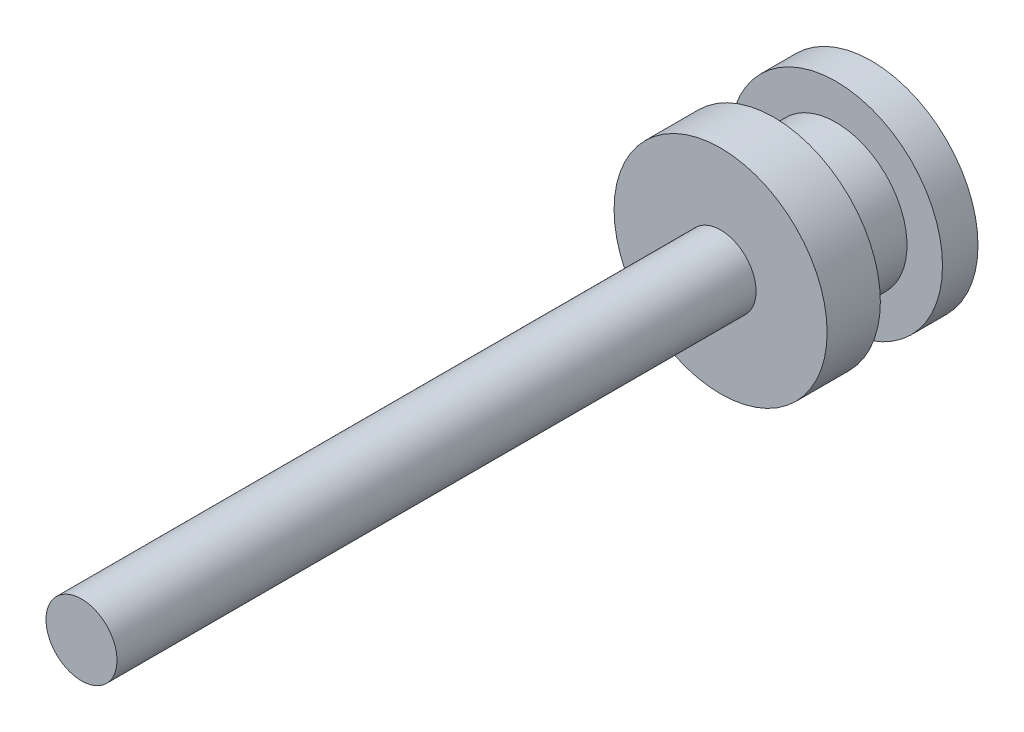
from build123d import *

# Parameters (mm, degrees)
SKIZZE1_R                       = 60
AUFSATZ_LINEAR_AUSTRAGEN1_DEPTH = 30
SKIZZE2_R                       = 20
AUFSATZ_LINEAR_AUSTRAGEN2_DEPTH = 360
SKIZZE3_R                       = 40
AUFSATZ_LINEAR_AUSTRAGEN3_DEPTH = 35
AUFSATZ_LINEAR_START            = 20
SKIZZE4_R                       = 60
AUFSATZ_LINEAR_AUSTRAGEN4_DEPTH = 20


with BuildPart() as part:
    # Skizze1 → Aufsatz-Linear austragen1 (new body)
    with BuildSketch(Plane.XY):
        Circle(SKIZZE1_R)
    extrude(amount=AUFSATZ_LINEAR_AUSTRAGEN1_DEPTH)

    # Skizze2 → Aufsatz-Linear austragen2 (add)
    with BuildSketch(Plane.XY.offset(30)):
        with Locations(Location((0, 0, 0), (0, 0, 180))):
            Circle(SKIZZE2_R)
    extrude(amount=AUFSATZ_LINEAR_AUSTRAGEN2_DEPTH)

    # Skizze3 → Aufsatz-Linear austragen3 (add)
    with BuildSketch(Plane(origin=(0, 0, 0), x_dir=(-1, 0, 0), z_dir=(0, 0, -1))):
        Circle(SKIZZE3_R)
    extrude(amount=AUFSATZ_LINEAR_AUSTRAGEN3_DEPTH)

    # Skizze4 → Aufsatz-Linear austragen4 (add)
    with BuildSketch(Plane(origin=(0, 0, -35), x_dir=(-1, 0, 0), z_dir=(0, 0, -1)).offset(AUFSATZ_LINEAR_START)):
        with Locations(Location((0, 0, 0), (0, 0, 180))):
            Circle(SKIZZE4_R)
    extrude(amount=-AUFSATZ_LINEAR_AUSTRAGEN4_DEPTH)


solid = part.part
